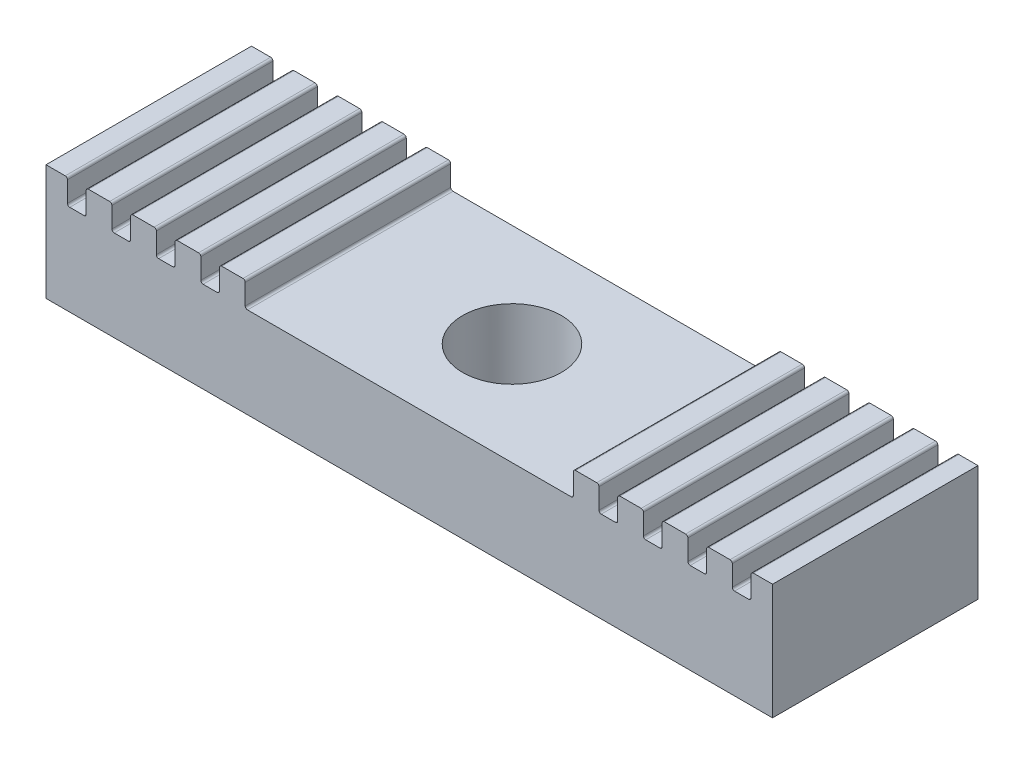
from build123d import *
from build123d.topology import SkipClean

# Parameters (mm, degrees)
BOSS_EXTRUDE1_DEPTH = 5.1
SKETCH2_W           = 14.45
SKETCH2_H           = 1.1
CUT_EXTRUDE1_DEPTH  = 23.625704409
SKETCH3_W           = 0.825
SKETCH3_H           = 1.1
CUT_EXTRUDE2_DEPTH  = 10
FILLET1_R           = 0.1
SKETCH4_W           = 4.1
SKETCH4_H           = 5.1
CUT_EXTRUDE3_DEPTH  = 10


with BuildPart() as part:
    # Sketch1 → Boss-Extrude1 (new body)
    with BuildSketch(Plane(origin=(0, 0, 0), x_dir=(1, 0, 0), z_dir=(0, 1, 0))):
        with BuildLine():
            Line((20.1, 4.525), (0, 4.525))
            Line((0, 4.525), (0, 2.175))
            ThreePointArc((0, 2.175), (1.537957249, 1.537957249), (2.175, 0))
            Line((2.175, 0), (20.1, 0))
            Line((20.1, 0), (20.1, 4.525))
        make_face()
        with BuildLine():
            Line((20.1, 0), (2.175, 0))
            ThreePointArc((2.175, 0), (1.537957249, -1.537957249), (0, -2.175))
            Line((0, -2.175), (0, -4.525))
            Line((0, -4.525), (20.1, -4.525))
            Line((20.1, -4.525), (20.1, 0))
        make_face()
    extrude(amount=BOSS_EXTRUDE1_DEPTH)

    # Sketch2 → Cut-Extrude1 (cut, through all)
    with BuildSketch(Plane.XY.offset(4.525)):
        with Locations((0, 4.55)):
            Rectangle(SKETCH2_W, SKETCH2_H)
    extrude(amount=-CUT_EXTRUDE1_DEPTH, mode=Mode.SUBTRACT)

    # Sketch3 → Cut-Extrude2 (cut)
    with BuildSketch(Plane.XY.offset(4.525)):
        with Locations((8.769642857, 4.55)):
            Rectangle(SKETCH3_W, SKETCH3_H)
        with Locations((10.726785714, 4.55)):
            Rectangle(SKETCH3_W, SKETCH3_H)
        with Locations((12.683928571, 4.55)):
            Rectangle(SKETCH3_W, SKETCH3_H)
        with Locations((14.641071429, 4.55)):
            Rectangle(SKETCH3_W, SKETCH3_H)
        with Locations((16.598214286, 4.55)):
            Rectangle(SKETCH3_W, SKETCH3_H)
        with Locations((18.555357143, 4.55)):
            Rectangle(SKETCH3_W, SKETCH3_H)
    extrude(amount=-CUT_EXTRUDE2_DEPTH, mode=Mode.SUBTRACT)

    # Fillet1
    fillet1_edges = [part.edges().sort_by_distance(p)[0] for p in [
        (14.228571429, 4, 0),
        (15.053571429, 4, 0),
        (17.010714286, 5.1, 0),
        (16.185714286, 5.1, 0),
        (16.185714286, 4, 0),
        (17.010714286, 4, 0),
        (18.967857143, 5.1, 0),
        (18.142857143, 5.1, 0),
        (18.142857143, 4, 0),
        (18.967857143, 4, 0),
        (20.1, 5.1, 0),
        (7.225, 4, 0),
        (7.225, 5.1, 0),
        (9.182142857, 5.1, 0),
        (8.357142857, 5.1, 0),
        (8.357142857, 4, 0),
        (9.182142857, 4, 0),
        (11.139285714, 5.1, 0),
        (10.314285714, 5.1, 0),
        (10.314285714, 4, 0),
        (11.139285714, 4, 0),
        (13.096428571, 5.1, 0),
        (12.271428571, 5.1, 0),
        (12.271428571, 4, 0),
        (13.096428571, 4, 0),
        (15.053571429, 5.1, 0),
        (14.228571429, 5.1, 0),
    ]]
    fillet(fillet1_edges, radius=FILLET1_R)

    # Mirror3: part across plane


with BuildPart() as part_1:
    with SkipClean():  # the faces are left unmerged after this step: merging them gives an invalid solid
        add(part.part)
        add(part.part.mirror(Plane(origin=(0, 5.1, 0), x_dir=(0, 0, 1), z_dir=(1, 0, 0))))

    # Sketch4 → Cut-Extrude3 (cut)
    with SkipClean():  # the faces are left unmerged after this step: merging them gives an invalid solid
        with BuildSketch(Plane.XY.offset(4.525)):
            with Locations((18.05, 2.55)):
                Rectangle(SKETCH4_W, SKETCH4_H)
            with Locations((-18.05, 2.55)):
                Rectangle(SKETCH4_W, SKETCH4_H)
        extrude(amount=-CUT_EXTRUDE3_DEPTH, mode=Mode.SUBTRACT)


solid = part_1.part
